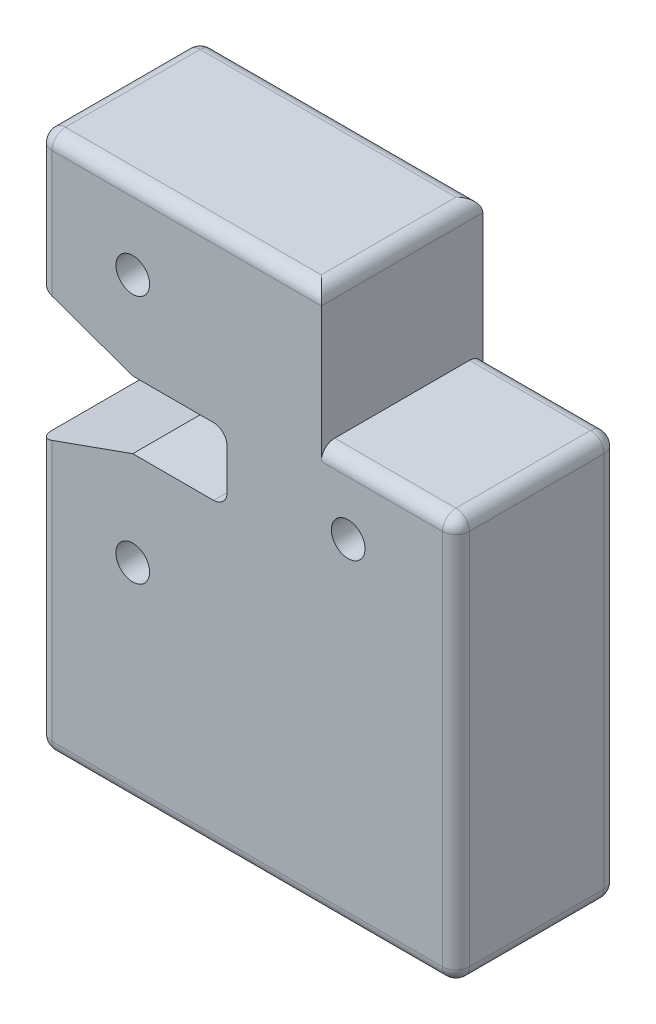
from build123d import *

# Parameters (mm, degrees)
SKETCH_1_R      = 1.25
EXTRUDE_1_DEPTH = 12
FILLET_1_R      = 1


with BuildPart() as part:
    # 草图1 → 凸台-拉伸1 (new body)
    with BuildSketch(Plane.XY):
        Polygon((0, 0), (21, 0), (21, -10), (31, -10), (31, -40), (0, -40), (0, -20), (7, -17.5), (14, -17.5), (14, -12.5), (7, -12.5), (0, -10), align=None)
        with Locations((7, -6)):
            Circle(SKETCH_1_R, mode=Mode.SUBTRACT)
        with Locations((23, -15)):
            Circle(SKETCH_1_R, mode=Mode.SUBTRACT)
        with Locations((7, -24.5)):
            Circle(SKETCH_1_R, mode=Mode.SUBTRACT)
    extrude(amount=EXTRUDE_1_DEPTH)

    # 圆角1
    fillet_1_edges = [part.edges().sort_by_distance(p)[0] for p in [
        (10.5, 0, 0),
        (26, -10, 0),
        (31, -25, 0),
        (15.5, -40, 0),
        (0, -30, 0),
        (0, -5, 0),
        (0, 0, 6),
        (21, 0, 6),
        (31, -10, 6),
        (31, -40, 6),
        (0, -40, 6),
        (14, -17.5, 6),
        (14, -12.5, 6),
        (0, -30, 12),
        (15.5, -40, 12),
        (31, -25, 12),
        (26, -10, 12),
        (10.5, 0, 12),
        (0, -5, 12),
    ]]
    fillet(fillet_1_edges, radius=FILLET_1_R)


solid = part.part
